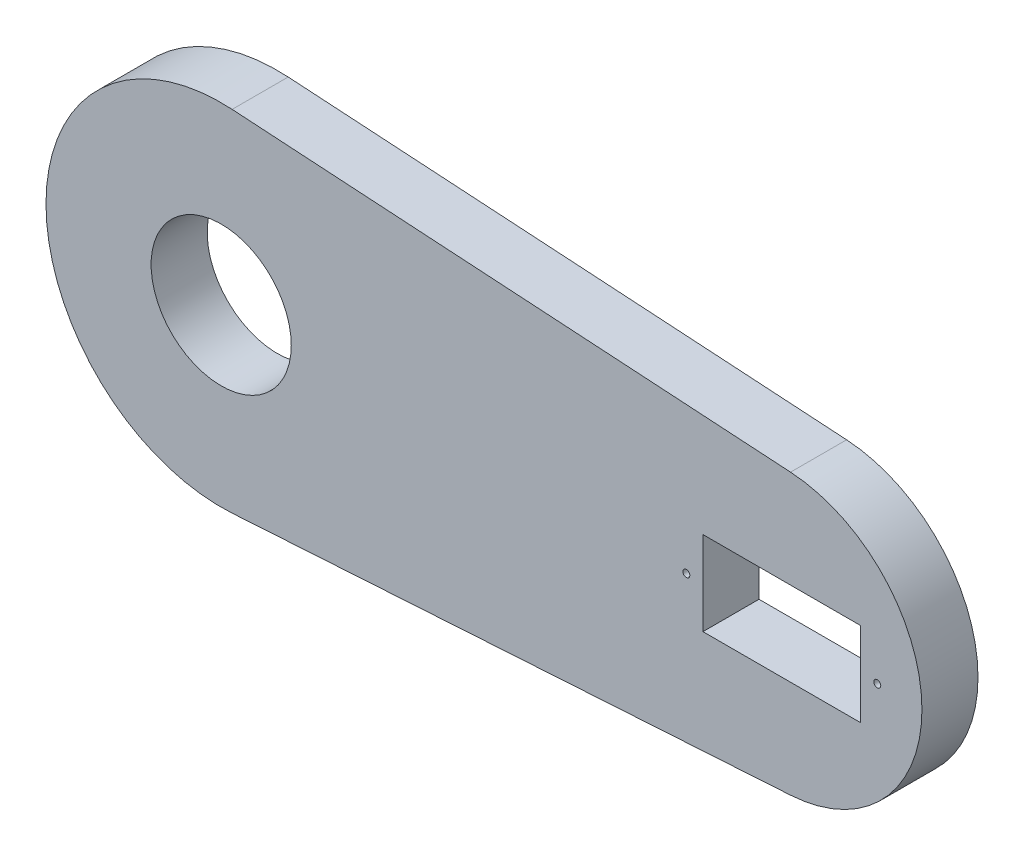
from build123d import *

# Parameters (mm, degrees)
CROQUIS1_R              = 0.8
CROQUIS1_R_2            = 0.5
CROQUIS1_W              = 22.5
CROQUIS1_H              = 12
SALIENTE_EXTRUIR1_DEPTH = 8
CROQUIS2_R              = 10
CORTAR_EXTRUIR1_DEPTH   = 104.387620149


with BuildPart() as part:
    # Croquis1 → Saliente-Extruir1 (new body)
    with BuildSketch(Plane.XY):
        with BuildLine():
            Line((1.5625, 24.951124098), (81.25, 19.960899278))
            ThreePointArc((81.25, 19.960899278), (100, 0), (81.25, -19.960899278))
            Line((81.25, -19.960899278), (1.5625, -24.951124098))
            ThreePointArc((1.5625, -24.951124098), (-25, 0), (1.5625, 24.951124098))
        make_face()
        Circle(CROQUIS1_R, mode=Mode.SUBTRACT)
        with Locations((66.375, 0)):
            Circle(CROQUIS1_R_2, mode=Mode.SUBTRACT)
        with Locations((93.625, 0)):
            Circle(CROQUIS1_R_2, mode=Mode.SUBTRACT)
        with Locations((7.5, 0)):
            Circle(CROQUIS1_R, mode=Mode.SUBTRACT)
        with Locations((0, -7.5)):
            Circle(CROQUIS1_R, mode=Mode.SUBTRACT)
        with Locations((-7.5, 0)):
            Circle(CROQUIS1_R, mode=Mode.SUBTRACT)
        with Locations((0, 7.5)):
            Circle(CROQUIS1_R, mode=Mode.SUBTRACT)
        with Locations((80, 0)):
            Rectangle(CROQUIS1_W, CROQUIS1_H, mode=Mode.SUBTRACT)
    extrude(amount=-SALIENTE_EXTRUIR1_DEPTH)

    # Croquis2 → Cortar-Extruir1 (cut, through all)
    with BuildSketch(Plane.XY):
        Circle(CROQUIS2_R)
    extrude(amount=-CORTAR_EXTRUIR1_DEPTH, mode=Mode.SUBTRACT)


solid = part.part
